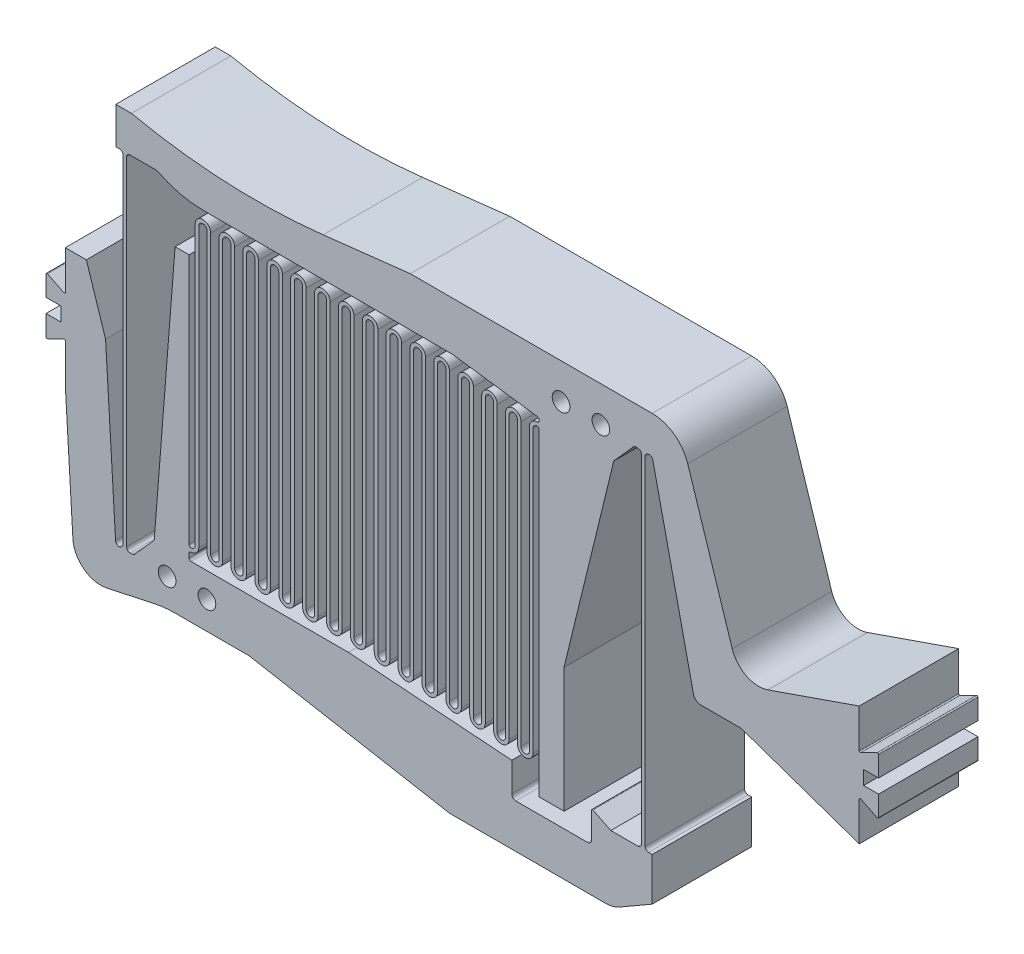
from build123d import *

# Parameters (mm, degrees)
SKETCH3_R           = 1.1303
BOSS_EXTRUDE2_DEPTH = 12.7


with BuildPart() as part:
    # Sketch3 → Boss-Extrude2 (new body)
    with BuildSketch(Plane.XY):
        with BuildLine():
            Line((2.4638, 40.194246705), (2.4638, 45.153950578))
            Line((2.4638, 45.153950578), (5.150190756, 45.153950578))
            Line((5.150190756, 45.153950578), (7.606146007, 37.598660304))
            Line((7.606146007, 37.598660304), (8.883331586, 15.964206778))
            ThreePointArc((8.883331586, 15.964206778), (9.02611846, 15.658471644), (9.339736967, 15.533950577))
            Line((9.339736967, 15.533950577), (9.365931672, 15.533950577))
            ThreePointArc((9.365931672, 15.533950577), (9.689220892, 15.667861357), (9.823131672, 15.991150577))
            Line((9.823131672, 15.991150577), (9.823131672, 59.076750578))
            ThreePointArc((9.823131672, 59.076750578), (9.689220892, 59.400039798), (9.365931672, 59.533950578))
            Line((9.365931672, 59.533950578), (8.908731672, 59.533950578))
            Line((8.908731672, 59.533950578), (8.908731672, 64.223243369))
            Line((8.908731672, 64.223243369), (10.899138198, 64.223243369))
            ThreePointArc((10.899138198, 64.223243369), (23.096537729, 62.637185071), (35.390213903, 63.034252238))
            Line((35.390213903, 63.034252238), (46.5057879, 64.296635746))
            Line((46.5057879, 64.296635746), (77.395931898, 64.296635746))
            ThreePointArc((77.395931898, 64.296635746), (80.199459042, 63.384068182), (81.928630923, 60.996075592))
            Line((81.928630923, 60.996075592), (87.612777409, 43.374788074))
            ThreePointArc((87.612777409, 43.374788074), (89.410821823, 41.283859637), (92.16285069, 41.106990884))
            Line((92.16285069, 41.106990884), (103.82504, 45.153950578))
            Line((103.82504, 45.153950578), (103.82504, 40.194246705))
            ThreePointArc((103.82504, 40.194246705), (103.885272149, 40.086214052), (104.008836127, 40.080654451))
            Line((104.008836127, 40.080654451), (106.105043873, 41.128758325))
            ThreePointArc((106.105043873, 41.128758325), (106.228607851, 41.123198725), (106.28884, 41.015166072))
            Line((106.28884, 41.015166072), (106.28884, 38.422950578))
            Line((106.28884, 38.422950578), (104.383840002, 38.422950578))
            Line((104.383840002, 38.422950578), (104.383840002, 36.644950578))
            Line((104.383840002, 36.644950578), (106.288840002, 36.644950578))
            Line((106.288840002, 36.644950578), (106.288840002, 34.052735084))
            ThreePointArc((106.288840002, 34.052735084), (106.228607853, 33.944702431), (106.105043875, 33.939142832))
            Line((106.105043875, 33.939142832), (104.008836128, 34.987246703))
            ThreePointArc((104.008836128, 34.987246703), (103.885272151, 34.981687103), (103.825040002, 34.87365445))
            Line((103.825040002, 34.87365445), (103.825040002, 29.913950577))
            Line((103.825040002, 29.913950577), (88.728716062, 35.152607994))
            Line((88.728716062, 35.152607994), (83.56452319, 35.152607994))
            ThreePointArc((83.56452319, 35.152607994), (82.992602324, 35.353541889), (82.672033793, 35.868035546))
            Line((82.672033793, 35.868035546), (77.475680953, 59.1762368))
            ThreePointArc((77.475680953, 59.1762368), (77.315396687, 59.433483629), (77.029436254, 59.533950577))
            Line((77.029436254, 59.533950577), (76.938731899, 59.533950577))
            ThreePointArc((76.938731899, 59.533950577), (76.615442679, 59.400039797), (76.481531899, 59.076750577))
            Line((76.481531899, 59.076750577), (76.481531899, 15.991150576))
            ThreePointArc((76.481531899, 15.991150576), (76.615442679, 15.667861355), (76.938731899, 15.533950576))
            Line((76.938731899, 15.533950576), (77.395931899, 15.533950576))
            Line((77.395931899, 15.533950576), (77.395931899, 10.034475448))
            Line((77.395931899, 10.034475448), (73.219219478, 7.623049407))
            ThreePointArc((73.219219478, 7.623049407), (72.361580002, 7.267803505), (71.441219478, 7.146635743))
            Line((71.441219478, 7.146635743), (51.519780707, 7.146635743))
            Line((51.519780707, 7.146635743), (25.904599129, 11.759776441))
            Line((25.904599129, 11.759776441), (16.508369806, 11.759776441))
            ThreePointArc((16.508369806, 11.759776441), (15.167443474, 11.688787351), (13.841507872, 11.476613696))
            Line((13.841507872, 11.476613696), (7.73335728, 10.164718085))
            ThreePointArc((7.73335728, 10.164718085), (4.834216412, 10.810844912), (3.436816309, 13.431869636))
            Line((3.436816309, 13.431869636), (2.4638, 29.913950578))
            Line((2.4638, 29.913950578), (2.4638, 34.873654451))
            ThreePointArc((2.4638, 34.873654451), (2.403567851, 34.981687104), (2.280003873, 34.987246704))
            Line((2.280003873, 34.987246704), (0.183796127, 33.93914283))
            ThreePointArc((0.183796127, 33.93914283), (0.060232149, 33.944702431), (0, 34.052735084))
            Line((0, 34.052735084), (0, 36.644950577))
            Line((0, 36.644950577), (1.905, 36.644950577))
            Line((1.905, 36.644950577), (1.905, 38.422950577))
            Line((1.905, 38.422950577), (0, 38.422950577))
            Line((0, 38.422950577), (0, 41.015166071))
            ThreePointArc((0, 41.015166071), (0.060232149, 41.123198724), (0.183796127, 41.128758323))
            Line((0.183796127, 41.128758323), (2.280003873, 40.080654452))
            ThreePointArc((2.280003873, 40.080654452), (2.403567851, 40.086214052), (2.4638, 40.194246705))
        make_face()
        with Locations((15.466331785, 15.308740524)):
            Circle(SKETCH3_R, mode=Mode.SUBTRACT)
        with Locations((20.546331785, 15.308740524)):
            Circle(SKETCH3_R, mode=Mode.SUBTRACT)
        with Locations((70.838331785, 59.75916063)):
            Circle(SKETCH3_R, mode=Mode.SUBTRACT)
        with Locations((65.758331785, 59.75916063)):
            Circle(SKETCH3_R, mode=Mode.SUBTRACT)
        with BuildLine():
            Line((10.737531672, 15.533950577), (10.989343975, 15.533950577))
            ThreePointArc((10.989343975, 15.533950577), (11.176695421, 15.57409989), (11.33114209, 15.687496352))
            Line((11.33114209, 15.687496352), (13.815331785, 18.483740523))
            Line((13.815331785, 18.483740523), (16.482249672, 52.265740523))
            Line((16.482249672, 52.265740523), (18.260249672, 52.265740523))
            Line((18.260249672, 52.265740523), (18.260249672, 20.236340523))
            ThreePointArc((18.260249672, 20.236340523), (18.334631354, 20.056748597), (18.514212349, 19.982340534))
            ThreePointArc((18.514212349, 19.982340534), (18.891433771, 20.138542059), (19.047690729, 20.515740524))
            Line((19.047690729, 20.515740524), (19.047690729, 56.05216063))
            ThreePointArc((19.047690729, 56.05216063), (20.038290729, 57.04276063), (21.028890729, 56.05216063))
            Line((21.028890729, 56.05216063), (21.028890729, 20.515740524))
            ThreePointArc((21.028890729, 20.515740524), (21.562290729, 19.982340524), (22.095690729, 20.515740524))
            Line((22.095690729, 20.515740524), (22.095690729, 56.05216063))
            ThreePointArc((22.095690729, 56.05216063), (23.086290729, 57.04276063), (24.076890729, 56.05216063))
            Line((24.076890729, 56.05216063), (24.076890729, 20.515740524))
            ThreePointArc((24.076890729, 20.515740524), (24.610290729, 19.982340524), (25.143690729, 20.515740524))
            Line((25.143690729, 20.515740524), (25.143690729, 56.05216063))
            ThreePointArc((25.143690729, 56.05216063), (26.134290729, 57.04276063), (27.124890729, 56.05216063))
            Line((27.124890729, 56.05216063), (27.124890729, 20.515740524))
            ThreePointArc((27.124890729, 20.515740524), (27.658290729, 19.982340524), (28.191690729, 20.515740524))
            Line((28.191690729, 20.515740524), (28.191690729, 56.05216063))
            ThreePointArc((28.191690729, 56.05216063), (29.182290729, 57.04276063), (30.172890729, 56.05216063))
            Line((30.172890729, 56.05216063), (30.172890729, 20.515740524))
            ThreePointArc((30.172890729, 20.515740524), (30.706290729, 19.982340524), (31.239690729, 20.515740524))
            Line((31.239690729, 20.515740524), (31.239690729, 56.05216063))
            ThreePointArc((31.239690729, 56.05216063), (32.230290729, 57.04276063), (33.220890729, 56.05216063))
            Line((33.220890729, 56.05216063), (33.220890729, 20.515740524))
            ThreePointArc((33.220890729, 20.515740524), (33.754290729, 19.982340524), (34.287690729, 20.515740524))
            Line((34.287690729, 20.515740524), (34.287690729, 56.05216063))
            ThreePointArc((34.287690729, 56.05216063), (35.278290729, 57.04276063), (36.268890729, 56.05216063))
            Line((36.268890729, 56.05216063), (36.268890729, 20.515740524))
            ThreePointArc((36.268890729, 20.515740524), (36.802290729, 19.982340524), (37.335690729, 20.515740524))
            Line((37.335690729, 20.515740524), (37.335690729, 56.05216063))
            ThreePointArc((37.335690729, 56.05216063), (38.326290729, 57.04276063), (39.316890729, 56.05216063))
            Line((39.316890729, 56.05216063), (39.316890729, 20.515740524))
            ThreePointArc((39.316890729, 20.515740524), (39.850290729, 19.982340524), (40.383690729, 20.515740524))
            Line((40.383690729, 20.515740524), (40.383690729, 56.05216063))
            ThreePointArc((40.383690729, 56.05216063), (41.374290729, 57.04276063), (42.364890729, 56.05216063))
            Line((42.364890729, 56.05216063), (42.364890729, 20.211171067))
            ThreePointArc((42.364890729, 20.211171067), (42.898290729, 19.677771067), (43.431690729, 20.211171067))
            Line((43.431690729, 20.211171067), (43.431690729, 56.05216063))
            ThreePointArc((43.431690729, 56.05216063), (44.422290729, 57.04276063), (45.412890729, 56.05216063))
            Line((45.412890729, 56.05216063), (45.412890729, 19.991827043))
            ThreePointArc((45.412890729, 19.991827043), (45.946290729, 19.458427043), (46.479690729, 19.991827043))
            Line((46.479690729, 19.991827043), (46.479690729, 56.05216063))
            ThreePointArc((46.479690729, 56.05216063), (47.470290729, 57.04276063), (48.460890729, 56.05216063))
            Line((48.460890729, 56.05216063), (48.460890729, 19.772483019))
            ThreePointArc((48.460890729, 19.772483019), (48.994290729, 19.239083019), (49.527690729, 19.772483019))
            Line((49.527690729, 19.772483019), (49.527690729, 56.05216063))
            ThreePointArc((49.527690729, 56.05216063), (50.518290729, 57.04276063), (51.508890729, 56.05216063))
            Line((51.508890729, 56.05216063), (51.508890729, 19.553138993))
            ThreePointArc((51.508890729, 19.553138993), (52.042290729, 19.019738993), (52.575690729, 19.553138993))
            Line((52.575690729, 19.553138993), (52.575690729, 55.816378353))
            ThreePointArc((52.575690729, 55.816378353), (53.566290729, 56.806978353), (54.556890729, 55.816378353))
            Line((54.556890729, 55.816378353), (54.556890729, 19.333794969))
            ThreePointArc((54.556890729, 19.333794969), (55.090290729, 18.800394969), (55.623690729, 19.333794969))
            Line((55.623690729, 19.333794969), (55.623690729, 55.402585249))
            ThreePointArc((55.623690729, 55.402585249), (56.614290729, 56.393185249), (57.604890729, 55.402585249))
            Line((57.604890729, 55.402585249), (57.604890729, 19.114450944))
            ThreePointArc((57.604890729, 19.114450944), (58.138290729, 18.581050944), (58.671690729, 19.114450944))
            Line((58.671690729, 19.114450944), (58.671690729, 55.00936063))
            ThreePointArc((58.671690729, 55.00936063), (59.662290729, 55.99996063), (60.652890729, 55.00936063))
            Line((60.652890729, 55.00936063), (60.652890729, 19.114450944))
            ThreePointArc((60.652890729, 19.114450944), (61.186290729, 18.581050944), (61.719690729, 19.114450944))
            Line((61.719690729, 19.114450944), (61.719690729, 55.00936063))
            ThreePointArc((61.719690729, 55.00936063), (62.009845266, 55.709835123), (62.710331784, 55.99996063))
            ThreePointArc((62.710331784, 55.99996063), (62.889936907, 56.074355507), (62.964331784, 56.25396063))
            Line((62.964331784, 56.25396063), (62.964331784, 56.362313405))
            ThreePointArc((62.964331784, 56.362313405), (62.901636525, 56.529401694), (62.744501105, 56.614004599))
            Line((62.744501105, 56.614004599), (51.932338442, 58.081851825))
            ThreePointArc((51.932338442, 58.081851825), (51.91529274, 58.083582772), (51.898169125, 58.08416063))
            Line((51.898169125, 58.08416063), (20.079640242, 58.08416063))
            ThreePointArc((20.079640242, 58.08416063), (17.045473772, 58.451933182), (14.187036932, 59.533950578))
            Line((14.187036932, 59.533950578), (10.737531672, 59.533950578))
            ThreePointArc((10.737531672, 59.533950578), (10.414242452, 59.400039798), (10.280331672, 59.076750578))
            Line((10.280331672, 59.076750578), (10.280331672, 15.991150577))
            ThreePointArc((10.280331672, 15.991150577), (10.414242452, 15.667861356), (10.737531672, 15.533950577))
        make_face(mode=Mode.SUBTRACT)
        with BuildLine():
            Line((18.260249672, 19.271140524), (18.260249672, 18.737740524))
            ThreePointArc((18.260249672, 18.737740524), (18.33464455, 18.558135402), (18.514249672, 18.483740524))
            Line((18.514249672, 18.483740524), (38.620362226, 18.483740524))
            Line((38.620362226, 18.483740524), (59.464331673, 16.983740476))
            Line((59.464331673, 16.983740476), (59.464331673, 13.242635744))
            ThreePointArc((59.464331673, 13.242635744), (59.613121428, 12.883425499), (59.972331673, 12.734635744))
            Line((59.972331673, 12.734635744), (69.131331897, 12.734635744))
            ThreePointArc((69.131331897, 12.734635744), (69.490542142, 12.883425499), (69.639331897, 13.242635744))
            Line((69.639331897, 13.242635744), (69.639331897, 16.545577411))
            ThreePointArc((69.639331897, 16.545577411), (69.699248391, 16.653414339), (69.822462656, 16.659499919))
            Line((69.822462656, 16.659499919), (72.106867952, 15.533950577))
            Line((72.106867952, 15.533950577), (75.567131898, 15.533950577))
            ThreePointArc((75.567131898, 15.533950577), (75.890421118, 15.667861357), (76.024331898, 15.991150577))
            Line((76.024331898, 15.991150577), (76.024331898, 59.076750578))
            ThreePointArc((76.024331898, 59.076750578), (75.890421118, 59.400039798), (75.567131898, 59.533950578))
            Line((75.567131898, 59.533950578), (75.315319598, 59.533950578))
            ThreePointArc((75.315319598, 59.533950578), (75.127968152, 59.493801265), (74.973521483, 59.380404803))
            Line((74.973521483, 59.380404803), (72.489331785, 56.584160631))
            Line((72.489331785, 56.584160631), (66.146591683, 30.627716522))
            ThreePointArc((66.146591683, 30.627716522), (66.14115329, 30.597787458), (66.139331785, 30.567422888))
            Line((66.139331785, 30.567422888), (66.139331785, 14.674179745))
            Line((66.139331785, 14.674179745), (62.964331785, 14.674179745))
            Line((62.964331785, 14.674179745), (62.964331784, 55.288760631))
            ThreePointArc((62.964331784, 55.288760631), (62.889922392, 55.46838027), (62.710290729, 55.54276063))
            ThreePointArc((62.710290729, 55.54276063), (62.333119971, 55.386531387), (62.176890729, 55.00936063))
            Line((62.176890729, 55.00936063), (62.176890729, 19.114450944))
            ThreePointArc((62.176890729, 19.114450944), (61.186290729, 18.123850944), (60.195690729, 19.114450944))
            Line((60.195690729, 19.114450944), (60.195690729, 55.00936063))
            ThreePointArc((60.195690729, 55.00936063), (59.662290729, 55.54276063), (59.128890729, 55.00936063))
            Line((59.128890729, 55.00936063), (59.128890729, 19.114450944))
            ThreePointArc((59.128890729, 19.114450944), (58.138290729, 18.123850944), (57.147690729, 19.114450944))
            Line((57.147690729, 19.114450944), (57.147690729, 55.402585249))
            ThreePointArc((57.147690729, 55.402585249), (56.614290729, 55.935985249), (56.080890729, 55.402585249))
            Line((56.080890729, 55.402585249), (56.080890729, 19.333794969))
            ThreePointArc((56.080890729, 19.333794969), (55.090290729, 18.343194969), (54.099690729, 19.333794969))
            Line((54.099690729, 19.333794969), (54.099690729, 55.816378353))
            ThreePointArc((54.099690729, 55.816378353), (53.566290729, 56.349778353), (53.032890729, 55.816378353))
            Line((53.032890729, 55.816378353), (53.032890729, 19.553138993))
            ThreePointArc((53.032890729, 19.553138993), (52.042290729, 18.562538993), (51.051690729, 19.553138993))
            Line((51.051690729, 19.553138993), (51.051690729, 56.05216063))
            ThreePointArc((51.051690729, 56.05216063), (50.518290729, 56.58556063), (49.984890729, 56.05216063))
            Line((49.984890729, 56.05216063), (49.984890729, 19.772483019))
            ThreePointArc((49.984890729, 19.772483019), (48.994290729, 18.781883019), (48.003690729, 19.772483019))
            Line((48.003690729, 19.772483019), (48.003690729, 56.05216063))
            ThreePointArc((48.003690729, 56.05216063), (47.470290729, 56.58556063), (46.936890729, 56.05216063))
            Line((46.936890729, 56.05216063), (46.936890729, 19.991827043))
            ThreePointArc((46.936890729, 19.991827043), (45.946290729, 19.001227043), (44.955690729, 19.991827043))
            Line((44.955690729, 19.991827043), (44.955690729, 56.05216063))
            ThreePointArc((44.955690729, 56.05216063), (44.422290729, 56.58556063), (43.888890729, 56.05216063))
            Line((43.888890729, 56.05216063), (43.888890729, 20.211171067))
            ThreePointArc((43.888890729, 20.211171067), (42.898290729, 19.220571067), (41.907690729, 20.211171067))
            Line((41.907690729, 20.211171067), (41.907690729, 56.05216063))
            ThreePointArc((41.907690729, 56.05216063), (41.374290729, 56.58556063), (40.840890729, 56.05216063))
            Line((40.840890729, 56.05216063), (40.840890729, 20.515740524))
            ThreePointArc((40.840890729, 20.515740524), (39.850290729, 19.525140524), (38.859690729, 20.515740524))
            Line((38.859690729, 20.515740524), (38.859690729, 56.05216063))
            ThreePointArc((38.859690729, 56.05216063), (38.326290729, 56.58556063), (37.792890729, 56.05216063))
            Line((37.792890729, 56.05216063), (37.792890729, 20.515740524))
            ThreePointArc((37.792890729, 20.515740524), (36.802290729, 19.525140524), (35.811690729, 20.515740524))
            Line((35.811690729, 20.515740524), (35.811690729, 56.05216063))
            ThreePointArc((35.811690729, 56.05216063), (35.278290729, 56.58556063), (34.744890729, 56.05216063))
            Line((34.744890729, 56.05216063), (34.744890729, 20.515740524))
            ThreePointArc((34.744890729, 20.515740524), (33.754290729, 19.525140524), (32.763690729, 20.515740524))
            Line((32.763690729, 20.515740524), (32.763690729, 56.05216063))
            ThreePointArc((32.763690729, 56.05216063), (32.230290729, 56.58556063), (31.696890729, 56.05216063))
            Line((31.696890729, 56.05216063), (31.696890729, 20.515740524))
            ThreePointArc((31.696890729, 20.515740524), (30.706290729, 19.525140524), (29.715690729, 20.515740524))
            Line((29.715690729, 20.515740524), (29.715690729, 56.05216063))
            ThreePointArc((29.715690729, 56.05216063), (29.182290729, 56.58556063), (28.648890729, 56.05216063))
            Line((28.648890729, 56.05216063), (28.648890729, 20.515740524))
            ThreePointArc((28.648890729, 20.515740524), (27.658290729, 19.525140524), (26.667690729, 20.515740524))
            Line((26.667690729, 20.515740524), (26.667690729, 56.05216063))
            ThreePointArc((26.667690729, 56.05216063), (26.134290729, 56.58556063), (25.600890729, 56.05216063))
            Line((25.600890729, 56.05216063), (25.600890729, 20.515740524))
            ThreePointArc((25.600890729, 20.515740524), (24.610290729, 19.525140524), (23.619690729, 20.515740524))
            Line((23.619690729, 20.515740524), (23.619690729, 56.05216063))
            ThreePointArc((23.619690729, 56.05216063), (23.086290729, 56.58556063), (22.552890729, 56.05216063))
            Line((22.552890729, 56.05216063), (22.552890729, 20.515740524))
            ThreePointArc((22.552890729, 20.515740524), (21.562290729, 19.525140524), (20.571690729, 20.515740524))
            Line((20.571690729, 20.515740524), (20.571690729, 56.05216063))
            ThreePointArc((20.571690729, 56.05216063), (20.038290729, 56.58556063), (19.504890729, 56.05216063))
            Line((19.504890729, 56.05216063), (19.504890729, 20.515740524))
            ThreePointArc((19.504890729, 20.515740524), (19.214736191, 19.815266031), (18.514249672, 19.525140524))
            ThreePointArc((18.514249672, 19.525140524), (18.33464455, 19.450745647), (18.260249672, 19.271140524))
        make_face(mode=Mode.SUBTRACT)
    extrude(amount=BOSS_EXTRUDE2_DEPTH)


solid = part.part
